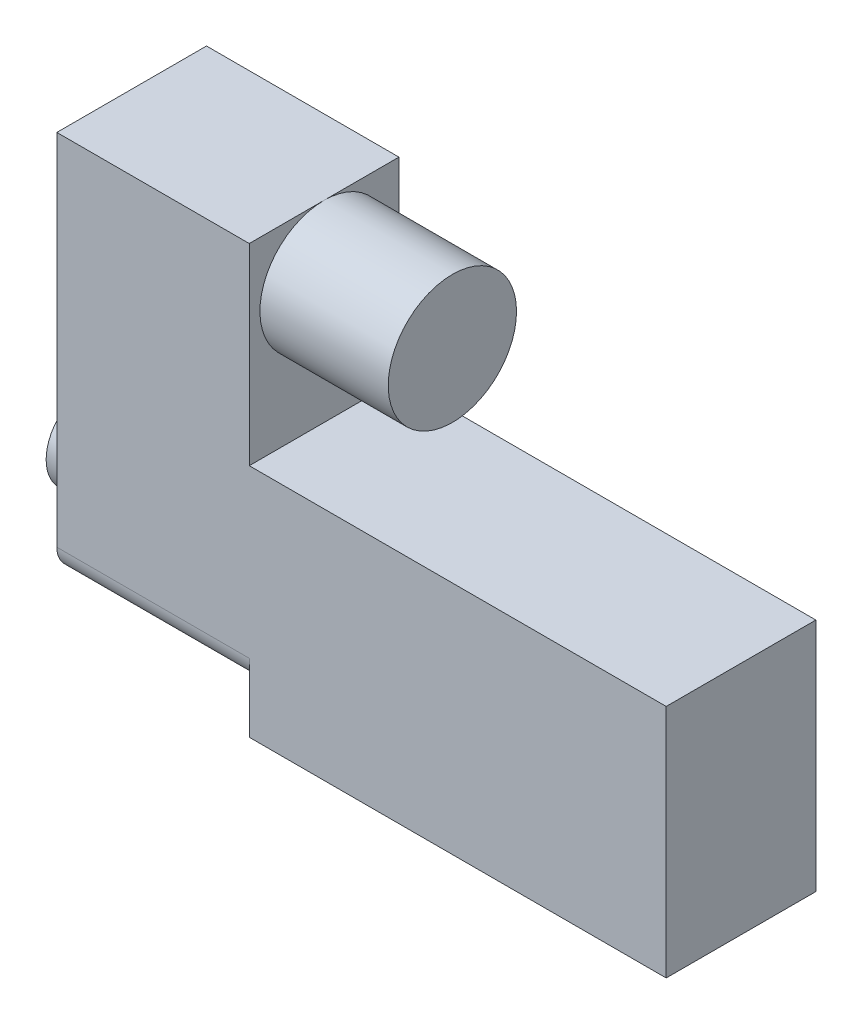
from build123d import *

# Parameters (mm, degrees)
SKETCH1_W           = 61.9125
SKETCH1_H           = 22.225
BOSS_EXTRUDE1_DEPTH = 34.925
SKETCH2_W           = 22.225
SKETCH2_H           = 28.575
BOSS_EXTRUDE2_DEPTH = 28.575
SKETCH3_W           = 28.575
SKETCH3_H           = 22.225
BOSS_EXTRUDE3_DEPTH = 28.575
SKETCH4_R           = 9.525
BOSS_EXTRUDE4_DEPTH = 19.05
SKETCH5_R           = 6.35
BOSS_EXTRUDE5_DEPTH = 6.35
FILLET1_R           = 3.81


with BuildPart() as part:
    # Sketch1 → Boss-Extrude1 (new body)
    with BuildSketch(Plane(origin=(0, 0, 0), x_dir=(1, 0, 0), z_dir=(0, 1, 0))):
        with Locations((30.95625, 11.1125)):
            Rectangle(SKETCH1_W, SKETCH1_H)
    extrude(amount=BOSS_EXTRUDE1_DEPTH)

    # Sketch2 → Boss-Extrude2 (add)
    with BuildSketch(Plane.ZY):
        with Locations((-11.1125, 20.6375)):
            Rectangle(SKETCH2_W, SKETCH2_H)
    extrude(amount=BOSS_EXTRUDE2_DEPTH)

    # Sketch3 → Boss-Extrude3 (add)
    with BuildSketch(Plane(origin=(0, 34.925, 0), x_dir=(1, 0, 0), z_dir=(0, 1, 0))):
        with Locations((-14.2875, 11.1125)):
            Rectangle(SKETCH3_W, SKETCH3_H)
    extrude(amount=BOSS_EXTRUDE3_DEPTH)

    # Sketch4 → Boss-Extrude4 (add)
    with BuildSketch(Plane(origin=(0, 0, 0), x_dir=(0, 0, -1), z_dir=(1, 0, 0))):
        with Locations(Location((11.1125, 53.975, 0), (0, 0, 90))):
            Circle(SKETCH4_R)
    extrude(amount=BOSS_EXTRUDE4_DEPTH)

    # Sketch5 → Boss-Extrude5 (add)
    with BuildSketch(Plane.ZY.offset(28.575)):
        with Locations((-11.1125, 15.875)):
            Circle(SKETCH5_R)
    extrude(amount=BOSS_EXTRUDE5_DEPTH)

    # Fillet1
    fillet1_edges = [part.edges().sort_by_distance(p)[0] for p in [
        (-14.2875, 6.35, -22.225),
        (-14.2875, 6.35, 0),
    ]]
    fillet(fillet1_edges, radius=FILLET1_R)


solid = part.part
